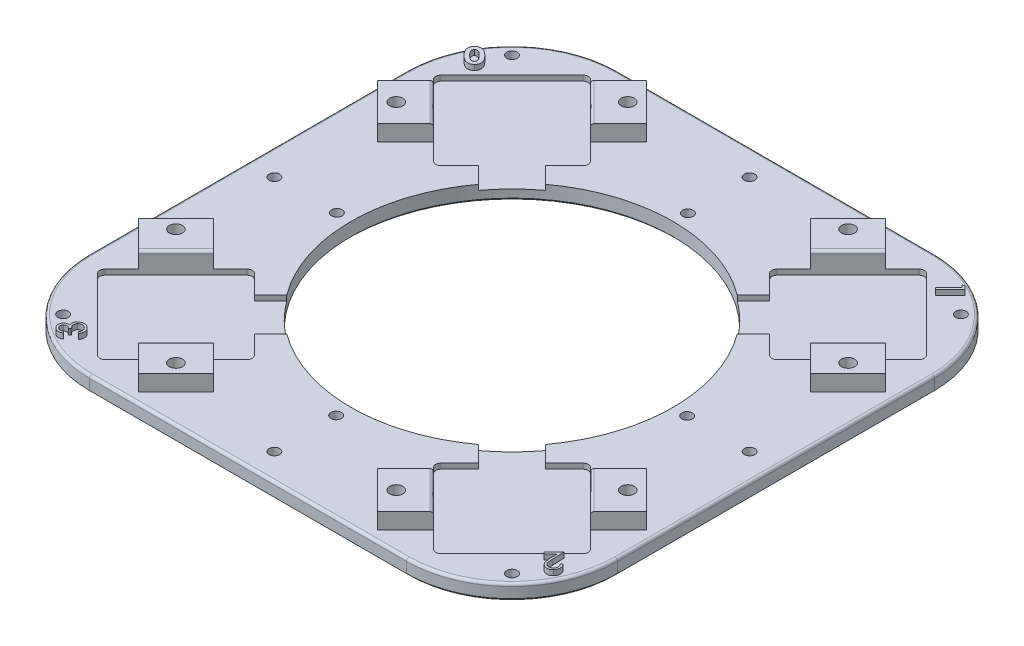
from build123d import *

# Parameters (mm, degrees)
SKETCH_1_W               = 200
SKETCH_1_H               = 200
SKETCH_1_R               = 2
EXTRUDE_1_DEPTH          = 6
CUT_EXTRUDE_1_DEPTH      = 2
FILLET_1_R               = 2
EXTRUDE_3_DEPTH          = 6
FILLET_4_R               = 40
SKETCH_4_R               = 2.5
CUT_EXTRUDE_2_DEPTH      = 8
SKETCH_7_R               = 12
SKETCH_7_W               = 40
SKETCH_7_H               = 12
SKETCH_7_W_2             = 12
SKETCH_7_H_2             = 40
CUT_EXTRUDE_3_DEPTH      = 6
CUT_EXTRUDE_4_DEPTH      = 2
FILLET_6_R               = 1
SKETCH_9_R               = 2
CUT_EXTRUDE_5_DEPTH      = 10
EXTRUDE_6_DEPTH          = 2
FILLET_9_R               = 1
CUT_EXTRUDE_6_DEPTH      = 142.548578234
CUT_EXTRUDE_6_DEPTH_BACK = 142.548578234
SKETCH_11_R              = 61
CHAMFER_1_SIZE           = 1


with BuildPart() as part:
    # Эскиз1 → Бобышка-Вытянуть1 (new body)
    with BuildSketch(Plane(origin=(0, 0, 0), x_dir=(1, 0, 0), z_dir=(0, 1, 0))):
        Rectangle(SKETCH_1_W, SKETCH_1_H)
        with Locations(Location((-90, 0, 0), (0, 0, 270))):
            Circle(SKETCH_1_R, mode=Mode.SUBTRACT)
        with Locations(Location((0, 90, 0), (0, 0, 270))):
            Circle(SKETCH_1_R, mode=Mode.SUBTRACT)
        with Locations(Location((90, 0, 0), (0, 0, 270))):
            Circle(SKETCH_1_R, mode=Mode.SUBTRACT)
        with Locations(Location((0, -90, 0), (0, 0, 270))):
            Circle(SKETCH_1_R, mode=Mode.SUBTRACT)
        with Locations(Location((-85, 85, 0), (0, 0, 270))):
            Circle(SKETCH_1_R, mode=Mode.SUBTRACT)
        with Locations(Location((85, 85, 0), (0, 0, 270))):
            Circle(SKETCH_1_R, mode=Mode.SUBTRACT)
        with Locations(Location((85, -85, 0), (0, 0, 270))):
            Circle(SKETCH_1_R, mode=Mode.SUBTRACT)
        with Locations(Location((-85, -85, 0), (0, 0, 270))):
            Circle(SKETCH_1_R, mode=Mode.SUBTRACT)
    extrude(amount=EXTRUDE_1_DEPTH)

    # Эскиз2 → Вырез-Вытянуть1 (cut)
    with BuildSketch(Plane(origin=(0, 6, 0), x_dir=(1, 0, 0), z_dir=(0, 1, 0))):
        Polygon((63.639610307, 33.941125497), (33.941125497, 63.639610307), (63.639610307, 93.338095117), (93.338095117, 63.639610307), align=None)
        Polygon((33.941125497, -63.639610307), (63.639610307, -33.941125497), (93.338095117, -63.639610307), (63.639610307, -93.338095117), align=None)
        Polygon((-63.639610307, -33.941125497), (-33.941125497, -63.639610307), (-63.639610307, -93.338095117), (-93.338095117, -63.639610307), align=None)
        Polygon((-33.941125497, 63.639610307), (-63.639610307, 33.941125497), (-93.338095117, 63.639610307), (-63.639610307, 93.338095117), align=None)
    extrude(amount=-CUT_EXTRUDE_1_DEPTH, mode=Mode.SUBTRACT)

    # Скругление1
    fillet_1_edges = [part.edges().sort_by_distance(p)[0] for p in [
        (93.338095117, 5, -63.639610307),
        (63.639610307, 5, -33.941125497),
        (33.941125497, 5, -63.639610307),
        (63.639610307, 5, -93.338095117),
        (-93.338095117, 5, 63.639610307),
        (-63.639610307, 5, 33.941125497),
        (-33.941125497, 5, 63.639610307),
        (-63.639610307, 5, 93.338095117),
        (-63.639610307, 5, -93.338095117),
        (-33.941125497, 5, -63.639610307),
        (-63.639610307, 5, -33.941125497),
        (-93.338095117, 5, -63.639610307),
        (63.639610307, 5, 93.338095117),
        (33.941125497, 5, 63.639610307),
        (63.639610307, 5, 33.941125497),
        (93.338095117, 5, 63.639610307),
    ]]
    fillet(fillet_1_edges, radius=FILLET_1_R)

    # Эскиз3 → Бобышка-Вытянуть3 (add)
    with BuildSketch(Plane(origin=(0, 6, 0), x_dir=(1, 0, 0), z_dir=(0, 1, 0))):
        Polygon((41.71930009, 71.4177849), (55.861435714, 85.559920524), (45.254833996, 96.166522241), (31.112698372, 82.024386618), align=None)
        Polygon((85.559920524, 55.861435714), (96.166522241, 45.254833996), (82.024386618, 31.112698372), (71.4177849, 41.71930009), align=None)
        Polygon((71.4177849, -41.71930009), (85.559920524, -55.861435714), (96.166522241, -45.254833996), (82.024386618, -31.112698372), align=None)
        Polygon((31.112698372, -82.024386618), (45.254833996, -96.166522241), (55.861435714, -85.559920524), (41.71930009, -71.4177849), align=None)
        Polygon((-41.71930009, -71.4177849), (-55.861435714, -85.559920524), (-45.254833996, -96.166522241), (-31.112698372, -82.024386618), align=None)
        Polygon((-85.559920524, -55.861435714), (-96.166522241, -45.254833996), (-82.024386618, -31.112698372), (-71.4177849, -41.71930009), align=None)
        Polygon((-71.4177849, 41.71930009), (-85.559920524, 55.861435714), (-96.166522241, 45.254833996), (-82.024386618, 31.112698372), align=None)
        Polygon((-31.112698372, 82.024386618), (-45.254833996, 96.166522241), (-55.861435714, 85.559920524), (-41.71930009, 71.4177849), align=None)
    extrude(amount=EXTRUDE_3_DEPTH)

    # Скругление4
    fillet_4_edges = [part.edges().sort_by_distance(p)[0] for p in [
        (100, 3, 100),
        (-100, 3, 100),
        (-100, 3, -100),
        (100, 3, -100),
    ]]
    fillet(fillet_4_edges, radius=FILLET_4_R)

    # Эскиз4 → Вырез-Вытянуть2 (cut)
    with BuildSketch(Plane(origin=(0, 12, 0), x_dir=(1, 0, 0), z_dir=(0, 1, 0))):
        with Locations(Location((41.71930009, 85.559920524, 0), (0, 0, 270))):
            Circle(SKETCH_4_R)
        with Locations(Location((85.559920524, 41.71930009, 0), (0, 0, 90))):
            Circle(SKETCH_4_R)
        with Locations(Location((85.559920524, -41.71930009, 0), (0, 0, 270))):
            Circle(SKETCH_4_R)
        with Locations(Location((41.71930009, -85.559920524, 0), (0, 0, 90))):
            Circle(SKETCH_4_R)
        with Locations(Location((-41.71930009, -85.559920524, 0), (0, 0, 270))):
            Circle(SKETCH_4_R)
        with Locations(Location((-85.559920524, -41.71930009, 0), (0, 0, 90))):
            Circle(SKETCH_4_R)
        with Locations(Location((-85.559920524, 41.71930009, 0), (0, 0, 270))):
            Circle(SKETCH_4_R)
        with Locations(Location((-41.71930009, 85.559920524, 0), (0, 0, 90))):
            Circle(SKETCH_4_R)
    extrude(amount=-CUT_EXTRUDE_2_DEPTH, mode=Mode.SUBTRACT)

    # Эскиз7 → Вырез-Вытянуть3 (cut)
    with BuildSketch(Plane(origin=(0, 6, 0), x_dir=(1, 0, 0), z_dir=(0, 1, 0))):
        with Locations(Location((28.284271247, 28.284271247, 0), (0, 0, 270))):
            Circle(SKETCH_7_R)
        with Locations(Location((28.284271247, -28.284271247, 0), (0, 0, 270))):
            Circle(SKETCH_7_R)
        with Locations(Location((-28.284271247, -28.284271247, 0), (0, 0, 270))):
            Circle(SKETCH_7_R)
        with Locations(Location((-28.284271247, 28.284271247, 0), (0, 0, 270))):
            Circle(SKETCH_7_R)
        with Locations((40, 0)):
            Rectangle(SKETCH_7_W, SKETCH_7_H)
        with Locations((0, 40)):
            Rectangle(SKETCH_7_W_2, SKETCH_7_H_2)
        with Locations((0, -40)):
            Rectangle(SKETCH_7_W_2, SKETCH_7_H_2)
        with Locations((-40, 0)):
            Rectangle(SKETCH_7_W, SKETCH_7_H)
    extrude(amount=-CUT_EXTRUDE_3_DEPTH, mode=Mode.SUBTRACT)

    # Эскиз8 → Вырез-Вытянуть4 (cut)
    with BuildSketch(Plane(origin=(0, 6, 0), x_dir=(1, 0, 0), z_dir=(0, 1, 0))):
        Polygon((44.547727215, 31.819805153), (31.819805153, 44.547727215), (53.033008589, 65.76093065), (65.76093065, 53.033008589), align=None)
        Polygon((65.76093065, -53.033008589), (53.033008589, -65.76093065), (31.819805153, -44.547727215), (44.547727215, -31.819805153), align=None)
        Polygon((-44.547727215, -31.819805153), (-31.819805153, -44.547727215), (-53.033008589, -65.76093065), (-65.76093065, -53.033008589), align=None)
        Polygon((-65.76093065, 53.033008589), (-53.033008589, 65.76093065), (-31.819805153, 44.547727215), (-44.547727215, 31.819805153), align=None)
    extrude(amount=-CUT_EXTRUDE_4_DEPTH, mode=Mode.SUBTRACT)

    # Скругление6
    fillet_6_edges = [part.edges().sort_by_distance(p)[0] for p in [
        (48.790367902, 12, -78.488852712),
        (78.488852712, 12, -48.790367902),
        (78.488852712, 12, 48.790367902),
        (48.790367902, 12, 78.488852712),
        (-48.790367902, 12, 78.488852712),
        (-78.488852712, 12, 48.790367902),
        (-78.488852712, 12, -48.790367902),
        (-48.790367902, 12, -78.488852712),
    ]]
    fillet(fillet_6_edges, radius=FILLET_6_R)

    # Эскиз9 → Вырез-Вытянуть5 (cut)
    with BuildSketch(Plane(origin=(0, 6, 0), x_dir=(1, 0, 0), z_dir=(0, 1, 0))):
        with Locations(Location((0.141931936, 66.467885895, 0), (0, 0, 270))):
            Circle(SKETCH_9_R)
        with Locations(Location((-0.141931936, -66.467885895, 0), (0, 0, 90))):
            Circle(SKETCH_9_R)
        with Locations(Location((66.467885895, -0.141931936, 0), (0, 0, 270))):
            Circle(SKETCH_9_R)
        with Locations(Location((-66.467885895, 0.141931936, 0), (0, 0, 90))):
            Circle(SKETCH_9_R)
    extrude(amount=-CUT_EXTRUDE_5_DEPTH, mode=Mode.SUBTRACT)

    # Эскиз10 → Бобышка-Вытянуть6 (add)
    # profile 1 of 4: a face of its own
    with BuildSketch(Plane(origin=(0, 6, 0), x_dir=(1, 0, 0), z_dir=(0, 1, 0))):
        with BuildLine():
            add(Edge.make_bspline(
                [(-93.008725725, 78.748142248), (-92.957598681, 78.797521313), (-92.85676014, 78.894912293), (-92.695816741, 79.025623668), (-92.532835835, 79.143607747), (-92.364444707, 79.244705894), (-92.19338747, 79.333809788), (-92.016821516, 79.405990635), (-91.83577231, 79.461704551), (-91.651864556, 79.505826632), (-91.463065577, 79.533008597), (-91.270612251, 79.544105355), (-91.074440499, 79.539176393), (-90.875174478, 79.51794816), (-90.671949254, 79.481192006), (-90.46586329, 79.425437226), (-90.254902601, 79.357171516), (-90.040488058, 79.269212477), (-89.819864955, 79.163420892), (-89.593527751, 79.033863441), (-89.359570967, 78.882570897), (-89.117138773, 78.709656313), (-88.869800196, 78.51114685), (-88.612296924, 78.293135309), (-88.348308293, 78.050855484), (-88.172747767, 77.8784765), (-88.082443673, 77.789808915)],
                knots=[0, 0, 0, 0, 0.898182766, 1.771497688, 2.618542862, 3.439672004, 4.25211909, 5.054711465, 5.847125212, 6.644844624, 7.443249755, 8.254994895, 9.079117631, 9.921086753, 10.786032602, 11.686927653, 12.618018076, 13.587382576, 14.61431454, 15.709081657, 16.881705886, 18.135395254, 19.471648796, 20.88972771, 22.400151059, 24, 24, 24, 24], degree=3))
            add(Edge.make_bspline(
                [(-88.082443673, 77.789808915), (-87.99267599, 77.698463012), (-87.818629055, 77.521356129), (-87.574075163, 77.254376099), (-87.352755723, 76.995556331), (-87.155322982, 76.743444497), (-86.979453593, 76.499753648), (-86.827635494, 76.263265193), (-86.697172812, 76.035199404), (-86.593983854, 75.812528771), (-86.505762897, 75.597863606), (-86.435650692, 75.388405368), (-86.380204903, 75.184114783), (-86.341999183, 74.984749296), (-86.317124562, 74.790489333), (-86.308824987, 74.600690128), (-86.317259045, 74.415819605), (-86.339029871, 74.235495262), (-86.378224262, 74.059121756), (-86.433011633, 73.88543721), (-86.503667028, 73.713843244), (-86.590455303, 73.544917992), (-86.694786221, 73.379663841), (-86.810937292, 73.213769659), (-86.94605157, 73.051911723), (-87.045954632, 72.949414733), (-87.09686675, 72.89718071)],
                knots=[0, 0, 0, 0, 1.626693129, 3.153929617, 4.597923221, 5.951226613, 7.220381534, 8.41370076, 9.519612414, 10.554665343, 11.5286677, 12.466351198, 13.358440621, 14.215441504, 15.042756246, 15.844148676, 16.625203713, 17.391079629, 18.148401381, 18.916678168, 19.701702082, 20.502864672, 21.325687275, 22.182312009, 23.073678591, 24, 24, 24, 24], degree=3))
            add(Edge.make_bspline(
                [(-87.09686675, 72.89718071), (-87.149001816, 72.84614528), (-87.251598834, 72.745712247), (-87.415449357, 72.611920711), (-87.581095452, 72.493010238), (-87.748111845, 72.387124201), (-87.920307836, 72.299502255), (-88.094627597, 72.225293141), (-88.272021467, 72.16710318), (-88.452198674, 72.125173685), (-88.635693302, 72.099819479), (-88.822639538, 72.088904452), (-89.013082719, 72.090828854), (-89.207091086, 72.1143069), (-89.40536909, 72.145719544), (-89.606567507, 72.199199877), (-89.811492576, 72.264759097), (-90.022238393, 72.344954071), (-90.237893224, 72.447094582), (-90.460693886, 72.571345842), (-90.692551034, 72.717439447), (-90.930254984, 72.890031869), (-91.177219561, 73.084109407), (-91.432290045, 73.301626079), (-91.696875667, 73.541020342), (-91.871055441, 73.713771109), (-91.960648802, 73.802629428)],
                knots=[0, 0, 0, 0, 0.933090558, 1.836236452, 2.703091185, 3.541342316, 4.363641911, 5.172278286, 5.963363672, 6.749235136, 7.536057157, 8.330354457, 9.143829215, 9.968822976, 10.828425831, 11.710347207, 12.629007139, 13.581006501, 14.593064946, 15.679156618, 16.843448976, 18.097249152, 19.435871615, 20.861513249, 22.385647378, 24, 24, 24, 24], degree=3))
            add(Edge.make_bspline(
                [(-91.960648802, 73.802629428), (-92.083808079, 73.927961036), (-92.321358131, 74.169701086), (-92.642974702, 74.539928393), (-92.927306321, 74.894846854), (-93.16830981, 75.240335887), (-93.371354338, 75.572879883), (-93.528165963, 75.896472645), (-93.650478298, 76.206379417), (-93.697573804, 76.414092671), (-93.720264186, 76.514167889)],
                knots=[0, 0, 0, 0, 1.286987725, 2.482346486, 3.591022616, 4.616940247, 5.566609133, 6.441717498, 7.249227199, 8, 8, 8, 8], degree=3))
            add(Edge.make_bspline(
                [(-93.720264186, 76.514167889), (-93.73621609, 76.619695189), (-93.767435565, 76.826222703), (-93.769463604, 77.134773214), (-93.73708647, 77.432890992), (-93.662918531, 77.719164849), (-93.557667587, 77.996586653), (-93.410830123, 78.260518954), (-93.228823871, 78.514820834), (-93.083287813, 78.669100547), (-93.008725725, 78.748142248)],
                knots=[0, 0, 0, 0, 1.045976366, 2.04708071, 3.017702948, 3.979968869, 4.940634868, 5.921098241, 6.93492198, 8, 8, 8, 8], degree=3))
        make_face()
        with BuildLine():
            add(Edge.make_bspline(
                [(-91.968661622, 77.762565325), (-92.010462791, 77.716369621), (-92.09267178, 77.625518043), (-92.185599358, 77.466056849), (-92.247808891, 77.292789759), (-92.277000053, 77.138763868), (-92.281564988, 77.009210942), (-92.272569584, 76.906266824), (-92.255217222, 76.798367336), (-92.225720447, 76.685914195), (-92.185705795, 76.569081549), (-92.133366823, 76.447952044), (-92.070623007, 76.322116087), (-91.998518706, 76.18904091), (-91.910791112, 76.051145738), (-91.80930652, 75.904601817), (-91.691866402, 75.749325648), (-91.559047432, 75.584504399), (-91.409818285, 75.411433598), (-91.243944165, 75.230965793), (-91.065124091, 75.039589219), (-90.938036359, 74.911792703), (-90.872507776, 74.845898658)],
                knots=[0, 0, 0, 0, 1.075604722, 2.115356592, 3.167844591, 4.248203041, 4.812243559, 5.405508209, 6.032984943, 6.700942317, 7.414044194, 8.167617197, 8.981822607, 9.846245724, 10.784711884, 11.80756956, 12.929501316, 14.151980212, 15.469127066, 16.882155306, 18.392386567, 20, 20, 20, 20], degree=3))
            add(Edge.make_bspline(
                [(-90.872507776, 74.845898658), (-90.7864976, 74.761480543), (-90.621676348, 74.599710156), (-90.376186673, 74.375708535), (-90.142591105, 74.181411662), (-89.920993001, 74.01580443), (-89.712979922, 73.876185004), (-89.516195184, 73.766835437), (-89.332031918, 73.684611929), (-89.159202852, 73.630270157), (-88.995766399, 73.602382197), (-88.842298, 73.587529693), (-88.696426487, 73.594737092), (-88.558484062, 73.616713591), (-88.427977695, 73.656297414), (-88.306707853, 73.716054158), (-88.190628178, 73.788553381), (-88.124171611, 73.852114178), (-88.090456494, 73.884360197)],
                knots=[0, 0, 0, 0, 1.768629636, 3.389223978, 4.875842697, 6.225868878, 7.447880289, 8.54973518, 9.52566295, 10.403516369, 11.200100902, 11.95533547, 12.661618695, 13.336984531, 14.001570975, 14.653788248, 15.317032326, 16, 16, 16, 16], degree=3))
            add(Edge.make_bspline(
                [(-88.090456494, 73.884360197), (-88.060170206, 73.917273087), (-88.000655379, 73.981949384), (-87.928154313, 74.090301918), (-87.872339217, 74.205569408), (-87.835909962, 74.32905055), (-87.814669853, 74.458862384), (-87.812602281, 74.595619521), (-87.824773104, 74.739340345), (-87.846722465, 74.835951399), (-87.858084699, 74.885962761)],
                knots=[0, 0, 0, 0, 0.992959701, 1.951240279, 2.885912978, 3.828695135, 4.802734124, 5.800367936, 6.861345669, 8, 8, 8, 8], degree=3))
            add(Edge.make_bspline(
                [(-87.858084699, 74.885962761), (-87.877060945, 74.949998607), (-87.916921532, 75.084509222), (-88.007273396, 75.286598194), (-88.126064612, 75.49901867), (-88.272102307, 75.722527903), (-88.44647396, 75.957027887), (-88.648604001, 76.202021519), (-88.880645166, 76.45665197), (-89.04719527, 76.627386506), (-89.133725725, 76.716090966)],
                knots=[0, 0, 0, 0, 0.710523542, 1.492491535, 2.35044932, 3.300180637, 4.333113065, 5.460466168, 6.680595133, 8, 8, 8, 8], degree=3))
            add(Edge.make_bspline(
                [(-89.133725725, 76.716090966), (-89.222964963, 76.803682764), (-89.394241612, 76.971797487), (-89.648507303, 77.205255058), (-89.891423716, 77.406883944), (-90.117816027, 77.583359819), (-90.333231584, 77.728162558), (-90.534384646, 77.845045557), (-90.723026558, 77.930887678), (-90.898556487, 77.990917344), (-91.063656834, 78.023876163), (-91.218731192, 78.040982929), (-91.365199368, 78.039958248), (-91.503588791, 78.020388828), (-91.63445609, 77.984561165), (-91.755276867, 77.926461343), (-91.869565032, 77.855138121), (-91.935391485, 77.793645199), (-91.968661622, 77.762565325)],
                knots=[0, 0, 0, 0, 1.794997963, 3.44513516, 4.953227072, 6.325945798, 7.563759521, 8.676594079, 9.661550624, 10.534529874, 11.333105772, 12.073249666, 12.771110835, 13.429383314, 14.075074024, 14.709742177, 15.347875331, 16, 16, 16, 16], degree=3))
        make_face(mode=Mode.SUBTRACT)
    # profile 2 of 4: a face of its own
    with BuildSketch(Plane(origin=(0, 6, 0), x_dir=(1, 0, 0), z_dir=(0, 1, 0))):
        Polygon((78.440095754, 93.074368887), (79.541057292, 91.973407348), (73.941698318, 86.374048374), (73.385608575, 86.930138118), (78.436890626, 91.981420169), (77.557082933, 92.861227861), align=None)
    # profile 3 of 4: a face of its own
    with BuildSketch(Plane(origin=(0, 6, 0), x_dir=(1, 0, 0), z_dir=(0, 1, 0))):
        with BuildLine():
            Line((92.978731613, -74.683298044), (93.515590587, -74.14643907))
            add(Edge.make_bspline(
                [(93.515590587, -74.14643907), (93.57979168, -74.217561095), (93.705938599, -74.357306758), (93.872192198, -74.580565611), (94.0096643, -74.812483922), (94.124946647, -75.049578001), (94.215404454, -75.292959176), (94.277694742, -75.544127868), (94.316788413, -75.801118589), (94.328555137, -76.062538369), (94.318422495, -76.32287574), (94.281216893, -76.576781617), (94.220051936, -76.822145442), (94.134830229, -77.05845039), (94.025582223, -77.28616355), (93.889081572, -77.503018406), (93.730477042, -77.712924928), (93.608225903, -77.841999489), (93.546039305, -77.907657019)],
                knots=[0, 0, 0, 0, 1.097080493, 2.155622548, 3.181877021, 4.180734131, 5.171877943, 6.149826956, 7.139761318, 8.144411119, 9.14266836, 10.119602376, 11.078258423, 12.0343727, 12.992188754, 13.965052194, 14.964864601, 16, 16, 16, 16], degree=3))
            add(Edge.make_bspline(
                [(93.546039305, -77.907657019), (93.482090698, -77.969428879), (93.356687631, -78.090563349), (93.151429875, -78.244882669), (92.942680032, -78.37895674), (92.725313898, -78.484156569), (92.502307063, -78.567304392), (92.272879379, -78.625036467), (92.036408861, -78.657581549), (91.796858495, -78.662803423), (91.558717577, -78.647071576), (91.328114136, -78.610221179), (91.106309941, -78.554059657), (90.894170445, -78.476955727), (90.69100415, -78.378911034), (90.498450265, -78.258608397), (90.312382857, -78.122050971), (90.200365868, -78.014736799), (90.143795716, -77.960541634)],
                knots=[0, 0, 0, 0, 1.122093018, 2.200421744, 3.237554738, 4.251534574, 5.244276876, 6.239309773, 7.233678941, 8.25294369, 9.26061734, 10.244606756, 11.198736813, 12.14649875, 13.09110873, 14.042419092, 15.011394142, 16, 16, 16, 16], degree=3))
            add(Edge.make_bspline(
                [(90.143795716, -77.960541634), (90.06838982, -77.879576092), (89.91877248, -77.718927525), (89.733967572, -77.445845524), (89.584072127, -77.153182093), (89.489411425, -76.889885212), (89.430647816, -76.660895349), (89.391527922, -76.464896649), (89.354319473, -76.246967695), (89.323162154, -76.005743563), (89.29417061, -75.742397125), (89.270319478, -75.45596892), (89.251579707, -75.147093558), (89.241802351, -74.933312205), (89.236744434, -74.822721121)],
                knots=[0, 0, 0, 0, 1.186803905, 2.354808508, 3.527369274, 4.71059022, 5.350674727, 6.065137202, 6.856453041, 7.724624025, 8.676850923, 9.701662735, 10.811048734, 12, 12, 12, 12], degree=3))
            Line((89.236744434, -74.822721121), (89.12616751, -71.926887788))
            Line((89.12616751, -71.926887788), (86.541231613, -74.511823685))
            Line((86.541231613, -74.511823685), (86.00116751, -73.971759583))
            Line((86.00116751, -73.971759583), (89.804052126, -70.168874967))
            Line((89.804052126, -70.168874967), (89.975526485, -74.61919548))
            add(Edge.make_bspline(
                [(89.975526485, -74.61919548), (89.97940604, -74.72712057), (89.986860215, -74.934487794), (90.003890674, -75.233029494), (90.019624168, -75.50625937), (90.043566004, -75.75394261), (90.06564968, -75.976592217), (90.095425878, -76.173535946), (90.124676221, -76.345461481), (90.168824981, -76.538523396), (90.23936523, -76.755529595), (90.356972999, -76.992365375), (90.498540406, -77.21240251), (90.616674642, -77.339291696), (90.675846998, -77.402849326)],
                knots=[0, 0, 0, 0, 1.320717269, 2.537625612, 3.657091802, 4.667335419, 5.580706193, 6.392834347, 7.10280944, 7.712944814, 8.814093938, 9.883466006, 10.93984752, 12, 12, 12, 12], degree=3))
            add(Edge.make_bspline(
                [(90.675846998, -77.402849326), (90.715762518, -77.440491138), (90.794563147, -77.514803044), (90.923578393, -77.611670036), (91.059857654, -77.691744666), (91.203081359, -77.756245876), (91.352325662, -77.808417727), (91.509417042, -77.84322442), (91.673171622, -77.86207557), (91.841072337, -77.867216475), (92.009961942, -77.855516387), (92.175462222, -77.830692716), (92.335424905, -77.788442162), (92.488974446, -77.730963732), (92.63686883, -77.65745526), (92.779385889, -77.569475576), (92.916642426, -77.465111951), (93.000335801, -77.384492124), (93.042834177, -77.343554455)],
                knots=[0, 0, 0, 0, 0.999414226, 1.973028734, 2.933162718, 3.874301026, 4.831864631, 5.809753659, 6.800020608, 7.832465231, 8.866744497, 9.881594604, 10.878159325, 11.876387246, 12.86478581, 13.883411814, 14.925224832, 16, 16, 16, 16], degree=3))
            add(Edge.make_bspline(
                [(93.042834177, -77.343554455), (93.085971983, -77.29897834), (93.170746275, -77.211377487), (93.280021317, -77.067662313), (93.371539202, -76.917986932), (93.447322526, -76.763501475), (93.507260364, -76.604334053), (93.549404033, -76.439373624), (93.572814515, -76.2684341), (93.581008072, -76.093006632), (93.571727119, -75.914621837), (93.542273015, -75.73648388), (93.495192881, -75.558323393), (93.430044659, -75.380806329), (93.34279892, -75.20509369), (93.240953397, -75.028485632), (93.118160612, -74.853500614), (93.025950971, -74.740939253), (92.978731613, -74.683298044)],
                knots=[0, 0, 0, 0, 1.00435318, 1.973751999, 2.917821866, 3.842935876, 4.757667598, 5.668706735, 6.595277109, 7.548310303, 8.510417973, 9.48367281, 10.468252952, 11.4923997, 12.541405892, 13.642871744, 14.792945286, 16, 16, 16, 16], degree=3))
        make_face()
    # profile 4 of 4: a face of its own
    with BuildSketch(Plane(origin=(0, 6, 0), x_dir=(1, 0, 0), z_dir=(0, 1, 0))):
        with BuildLine():
            Line((-77.388715553, -92.454657468), (-76.802177092, -93.02196516))
            add(Edge.make_bspline(
                [(-76.802177092, -93.02196516), (-76.872074017, -93.066285105), (-77.009193948, -93.153229528), (-77.221245979, -93.263222601), (-77.431874401, -93.355769168), (-77.64204283, -93.427893024), (-77.851510765, -93.48173737), (-78.060252855, -93.514710119), (-78.26822027, -93.532269537), (-78.474255518, -93.526358935), (-78.676988968, -93.504358079), (-78.873717005, -93.464118869), (-79.064802464, -93.407793132), (-79.248731568, -93.334076039), (-79.426690369, -93.243281798), (-79.598271698, -93.136210179), (-79.762535153, -93.010024629), (-79.865353835, -92.915908177), (-79.917561707, -92.868119006)],
                knots=[0, 0, 0, 0, 1.169279398, 2.293827799, 3.37245145, 4.41823223, 5.430864929, 6.42509182, 7.401967133, 8.376183799, 9.33334128, 10.280982312, 11.210249107, 12.145386172, 13.077317515, 14.030476502, 14.999942152, 16, 16, 16, 16], degree=3))
            add(Edge.make_bspline(
                [(-79.917561707, -92.868119006), (-79.988920031, -92.793915351), (-80.13012374, -92.647081306), (-80.306994952, -92.399433841), (-80.450747659, -92.133673041), (-80.562173881, -91.854130293), (-80.638288532, -91.566288195), (-80.673674749, -91.278376936), (-80.670891848, -90.993695007), (-80.628901464, -90.716257597), (-80.552855322, -90.450259759), (-80.442808141, -90.204893605), (-80.306804124, -89.977972028), (-80.190611, -89.848268388), (-80.132305297, -89.783183109)],
                knots=[0, 0, 0, 0, 1.079631469, 2.136372602, 3.182766178, 4.244954198, 5.288217467, 6.299582755, 7.281027378, 8.267633372, 9.236679149, 10.175611233, 11.084521819, 12, 12, 12, 12], degree=3))
            add(Edge.make_bspline(
                [(-80.132305297, -89.783183109), (-80.071332651, -89.724753249), (-79.951762443, -89.610169563), (-79.748381213, -89.471190926), (-79.532010491, -89.364348043), (-79.301508127, -89.289802953), (-79.057050132, -89.248329314), (-78.799158916, -89.239790928), (-78.527911531, -89.261925886), (-78.346160961, -89.301335363), (-78.252497604, -89.321644647)],
                knots=[0, 0, 0, 0, 0.994959293, 1.951161675, 2.892524362, 3.833211752, 4.798837926, 5.80788833, 6.870316961, 8, 8, 8, 8], degree=3))
            add(Edge.make_bspline(
                [(-78.252497604, -89.321644647), (-78.2908941, -89.227417901), (-78.366455678, -89.04198635), (-78.433533784, -88.752543136), (-78.468825619, -88.462397129), (-78.460297874, -88.26936548), (-78.456023245, -88.172606186)],
                knots=[0, 0, 0, 0, 1.034463078, 2.035749934, 3.015397462, 4, 4, 4, 4], degree=3))
            add(Edge.make_bspline(
                [(-78.456023245, -88.172606186), (-78.449288881, -88.105111251), (-78.436049064, -87.972415657), (-78.394386167, -87.778644977), (-78.340246105, -87.592612574), (-78.271950602, -87.41388508), (-78.185386109, -87.244752842), (-78.086329088, -87.082127181), (-77.970712952, -86.92772678), (-77.883148966, -86.832672184), (-77.839036066, -86.784785673)],
                knots=[0, 0, 0, 0, 1.04938919, 2.063107758, 3.062796941, 4.047250166, 5.019961658, 6.00006311, 6.992473739, 8, 8, 8, 8], degree=3))
            add(Edge.make_bspline(
                [(-77.839036066, -86.784785673), (-77.757764137, -86.707011683), (-77.595555492, -86.551784486), (-77.314339011, -86.362283402), (-77.00690324, -86.211377214), (-76.678775657, -86.096957633), (-76.337780488, -86.021689696), (-75.992384551, -85.998456457), (-75.648247161, -86.020429174), (-75.30852581, -86.092358394), (-74.975836653, -86.206866008), (-74.658919531, -86.369981879), (-74.355276993, -86.571977286), (-74.173558247, -86.737405252), (-74.081023245, -86.821644647)],
                knots=[0, 0, 0, 0, 0.966121529, 1.928258222, 2.902202989, 3.904812497, 4.910491246, 5.896124049, 6.872277065, 7.867065951, 8.874013802, 9.889062967, 10.92506653, 12, 12, 12, 12], degree=3))
            add(Edge.make_bspline(
                [(-74.081023245, -86.821644647), (-74.021853204, -86.881667927), (-73.905378738, -86.999821968), (-73.750010399, -87.188779842), (-73.616060265, -87.384318945), (-73.501384782, -87.584883398), (-73.407951202, -87.792558543), (-73.335758423, -88.006211938), (-73.283928402, -88.225649401), (-73.254012973, -88.449994375), (-73.243405037, -88.678597891), (-73.258616666, -88.909429614), (-73.295934925, -89.142204022), (-73.356030565, -89.376896446), (-73.437638527, -89.614740521), (-73.544783279, -89.853551775), (-73.672760277, -90.094886692), (-73.773237898, -90.251289766), (-73.824612989, -90.331260032)],
                knots=[0, 0, 0, 0, 1.045386523, 2.057812277, 3.030335339, 3.9831449, 4.920592867, 5.851197628, 6.777212156, 7.713628621, 8.655634425, 9.611918591, 10.578438017, 11.576706329, 12.614247281, 13.694355822, 14.821103873, 16, 16, 16, 16], degree=3))
            Line((-73.824612989, -90.331260032), (-74.387112989, -89.786388237))
            add(Edge.make_bspline(
                [(-74.387112989, -89.786388237), (-74.356108499, -89.729521047), (-74.295703021, -89.618727748), (-74.216755615, -89.452142222), (-74.152845056, -89.290175233), (-74.101233485, -89.134547193), (-74.061745375, -88.985413058), (-74.03787435, -88.841628771), (-74.0254386, -88.703252914), (-74.028325632, -88.612793387), (-74.029741194, -88.568439519)],
                knots=[0, 0, 0, 0, 1.208474665, 2.354448952, 3.437297787, 4.455450756, 5.412846772, 6.31251137, 7.172595194, 8, 8, 8, 8], degree=3))
            add(Edge.make_bspline(
                [(-74.029741194, -88.568439519), (-74.034859604, -88.513754216), (-74.045091811, -88.404432883), (-74.083607887, -88.244282225), (-74.135192606, -88.087829609), (-74.200435306, -87.934539232), (-74.284661095, -87.786835222), (-74.385183264, -87.644176856), (-74.498874455, -87.503469008), (-74.585051384, -87.416022074), (-74.629100169, -87.371324134)],
                knots=[0, 0, 0, 0, 0.961215761, 1.921565418, 2.877526972, 3.845915068, 4.834977089, 5.850130758, 6.901108131, 8, 8, 8, 8], degree=3))
            add(Edge.make_bspline(
                [(-74.629100169, -87.371324134), (-74.681090431, -87.322723333), (-74.782445027, -87.227976466), (-74.946347893, -87.106489871), (-75.110690459, -87.000747278), (-75.281027643, -86.917143209), (-75.454113249, -86.850977835), (-75.631241254, -86.803553156), (-75.812608999, -86.778698861), (-75.995053098, -86.770559067), (-76.175866677, -86.78030301), (-76.350156794, -86.805831688), (-76.517207594, -86.845992364), (-76.675973132, -86.901663669), (-76.826644699, -86.974919386), (-76.969041379, -87.0634642), (-77.105388267, -87.165921189), (-77.187099009, -87.245903166), (-77.228459143, -87.286388237)],
                knots=[0, 0, 0, 0, 1.175407728, 2.291447812, 3.366826222, 4.401376563, 5.421356114, 6.425777831, 7.424712672, 8.441055237, 9.440185163, 10.412905177, 11.348740396, 12.27587154, 13.188083527, 14.111845111, 15.044258618, 16, 16, 16, 16], degree=3))
            add(Edge.make_bspline(
                [(-77.228459143, -87.286388237), (-77.279535789, -87.343676672), (-77.381130905, -87.457627482), (-77.499712365, -87.655724529), (-77.592090729, -87.869391226), (-77.651660421, -88.098638567), (-77.68282183, -88.334507466), (-77.679719441, -88.572073434), (-77.641973735, -88.806620658), (-77.583578611, -88.999765985), (-77.514478245, -89.154475969), (-77.450854739, -89.280094261), (-77.369835179, -89.411062603), (-77.274409568, -89.548591317), (-77.16717371, -89.695487967), (-77.043439646, -89.847826927), (-76.907482639, -90.009367385), (-76.808529826, -90.115870536), (-76.757305297, -90.171003621)],
                knots=[0, 0, 0, 0, 1.121186236, 2.230119901, 3.361455773, 4.518304567, 5.684940395, 6.834367639, 7.982224936, 9.152000404, 9.775180233, 10.460538472, 11.21144107, 12.026855747, 12.910381899, 13.872566936, 14.898699748, 16, 16, 16, 16], degree=3))
            Line((-76.757305297, -90.171003621), (-77.268523245, -90.698247211))
            add(Edge.make_bspline(
                [(-77.268523245, -90.698247211), (-77.334741975, -90.637662351), (-77.464455594, -90.518984727), (-77.674721718, -90.365511058), (-77.893339725, -90.238268001), (-78.117019946, -90.138197165), (-78.337856669, -90.066171049), (-78.549142261, -90.022294312), (-78.748678618, -90.01180744), (-78.935354408, -90.032599171), (-79.107876819, -90.081434292), (-79.26675635, -90.152405628), (-79.412233777, -90.246112213), (-79.495636262, -90.325050512), (-79.537754015, -90.364913878)],
                knots=[0, 0, 0, 0, 1.265456482, 2.478859708, 3.664135126, 4.827966215, 5.929008543, 6.935492065, 7.863532652, 8.735702181, 9.573157525, 10.382716827, 11.183281726, 12, 12, 12, 12], degree=3))
            add(Edge.make_bspline(
                [(-79.537754015, -90.364913878), (-79.566835094, -90.396326023), (-79.624336337, -90.458436421), (-79.696526522, -90.562084864), (-79.756029374, -90.671258332), (-79.803081897, -90.78690076), (-79.837938732, -90.907750185), (-79.860995191, -91.034995575), (-79.869606859, -91.167658934), (-79.868291906, -91.304874511), (-79.854677693, -91.443051203), (-79.824958806, -91.578642797), (-79.783618958, -91.710304709), (-79.728268952, -91.83776375), (-79.660897843, -91.962176959), (-79.578201221, -92.082039768), (-79.484225877, -92.199700167), (-79.412386344, -92.272065664), (-79.37589504, -92.308824134)],
                knots=[0, 0, 0, 0, 0.945622928, 1.869755011, 2.784173497, 3.690084153, 4.624650255, 5.560708084, 6.543661072, 7.559560387, 8.592687063, 9.607418322, 10.623523625, 11.63942294, 12.675449106, 13.746764168, 14.855455909, 16, 16, 16, 16], degree=3))
            add(Edge.make_bspline(
                [(-79.37589504, -92.308824134), (-79.31341616, -92.364332751), (-79.191190113, -92.472923025), (-78.983632536, -92.597570118), (-78.763503707, -92.682251946), (-78.570315062, -92.721099458), (-78.409608163, -92.72848978), (-78.281445256, -92.725873293), (-78.147312061, -92.709585749), (-78.00752194, -92.679373618), (-77.861262426, -92.641186153), (-77.708597774, -92.591302884), (-77.550032642, -92.528408132), (-77.443524486, -92.47971492), (-77.388715553, -92.454657468)],
                knots=[0, 0, 0, 0, 1.401169659, 2.741077084, 4.038764372, 5.345842331, 6.028511183, 6.737373733, 7.496180119, 8.293104039, 9.137291959, 10.033670791, 10.988130031, 12, 12, 12, 12], degree=3))
        make_face()
    extrude(amount=EXTRUDE_6_DEPTH)

    # Скругление9
    fillet_9_edges = [part.edges().sort_by_distance(p)[0] for p in [
        (0, 6, -100),
        (100, 6, 0),
        (-100, 6, 0),
        (0, 6, 100),
        (-88.284271247, 6, -88.284271247),
        (-88.284271247, 6, 88.284271247),
        (88.284271247, 6, 88.284271247),
        (88.284271247, 6, -88.284271247),
    ]]
    fillet(fillet_9_edges, radius=FILLET_9_R)

    # Эскиз11 → Вырез-Вытянуть6 (cut, two sides: drawn at the far end of the back side and taken through both)
    with BuildSketch(Plane(origin=(0, 6, 0), x_dir=(1, 0, 0), z_dir=(0, 1, 0)).offset(-CUT_EXTRUDE_6_DEPTH_BACK)):
        with Locations(Location((0, 0, 0), (0, 0, 270))):
            Circle(SKETCH_11_R)
    extrude(amount=CUT_EXTRUDE_6_DEPTH + CUT_EXTRUDE_6_DEPTH_BACK, mode=Mode.SUBTRACT)

    # Фаска1
    chamfer_1_edges = [part.edges().sort_by_distance(p)[0] for p in [
        (0, 0, -92),
        (90, 0, -2),
        (0, 0, 88),
        (-90, 0, -2),
        (-85, 0, -87),
        (0, 0, -100),
        (100, 0, 0),
        (0, 0, 100),
        (-100, 0, 0),
        (-88.284271247, 0, -88.284271247),
        (-88.284271247, 0, 88.284271247),
        (88.284271247, 0, 88.284271247),
        (88.284271247, 0, -88.284271247),
        (85, 0, -87),
        (85, 0, 83),
        (-85, 0, 83),
        (0.141931936, 0, -68.467885895),
        (-0.141931936, 0, 68.467885895),
        (66.467885895, 0, -1.858068064),
        (-66.467885895, 0, 1.858068064),
        (0, 0, -61),
    ]]
    chamfer(chamfer_1_edges, length=CHAMFER_1_SIZE)


solid = part.part
